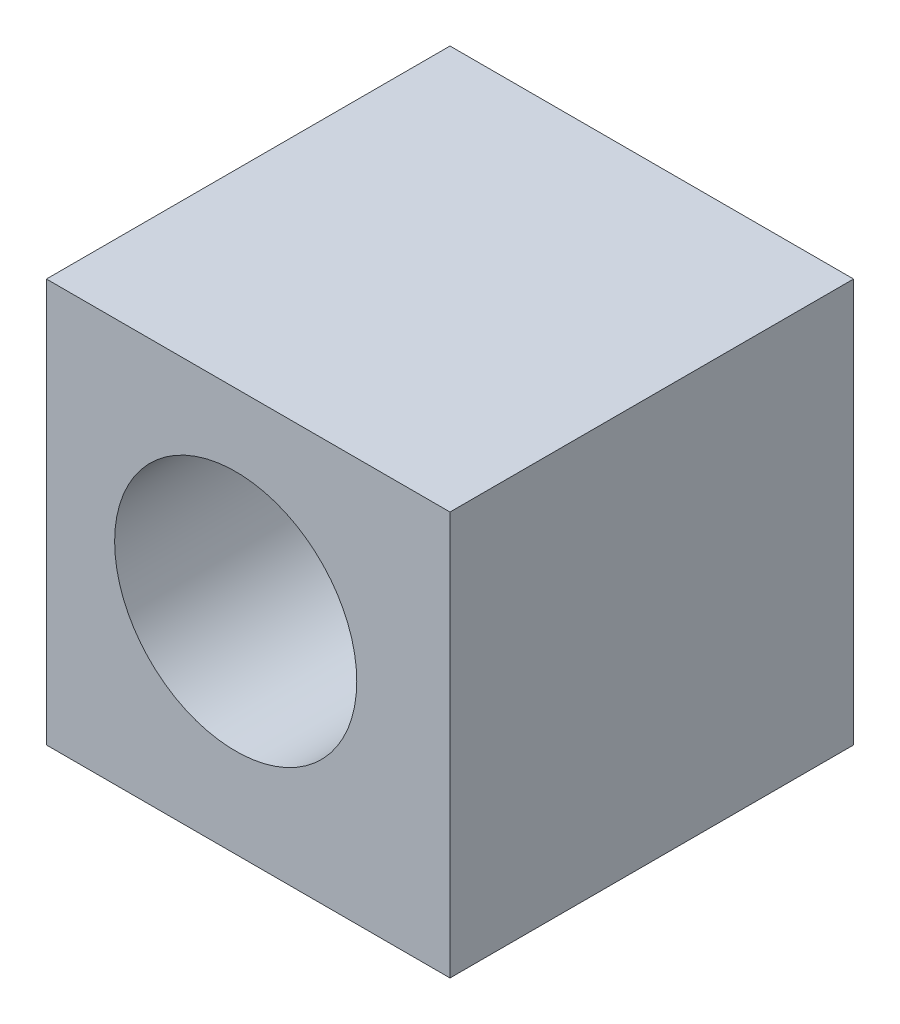
from build123d import *

# Parameters (mm, degrees)
SKETCH1_W           = 50
SKETCH1_H           = 50
BOSS_EXTRUDE1_DEPTH = 50
SKETCH2_R           = 15
CUT_EXTRUDE1_DEPTH  = 87.602540378


with BuildPart() as part:
    # Sketch1 → Boss-Extrude1 (new body)
    with BuildSketch(Plane.XY):
        with Locations((25, 25)):
            Rectangle(SKETCH1_W, SKETCH1_H)
    extrude(amount=BOSS_EXTRUDE1_DEPTH)

    # Sketch2 → Cut-Extrude1 (cut, through all)
    with BuildSketch(Plane.XY.offset(50)):
        with Locations((23.448676717, 26.063058993)):
            Circle(SKETCH2_R)
    extrude(amount=-CUT_EXTRUDE1_DEPTH, mode=Mode.SUBTRACT)


solid = part.part
